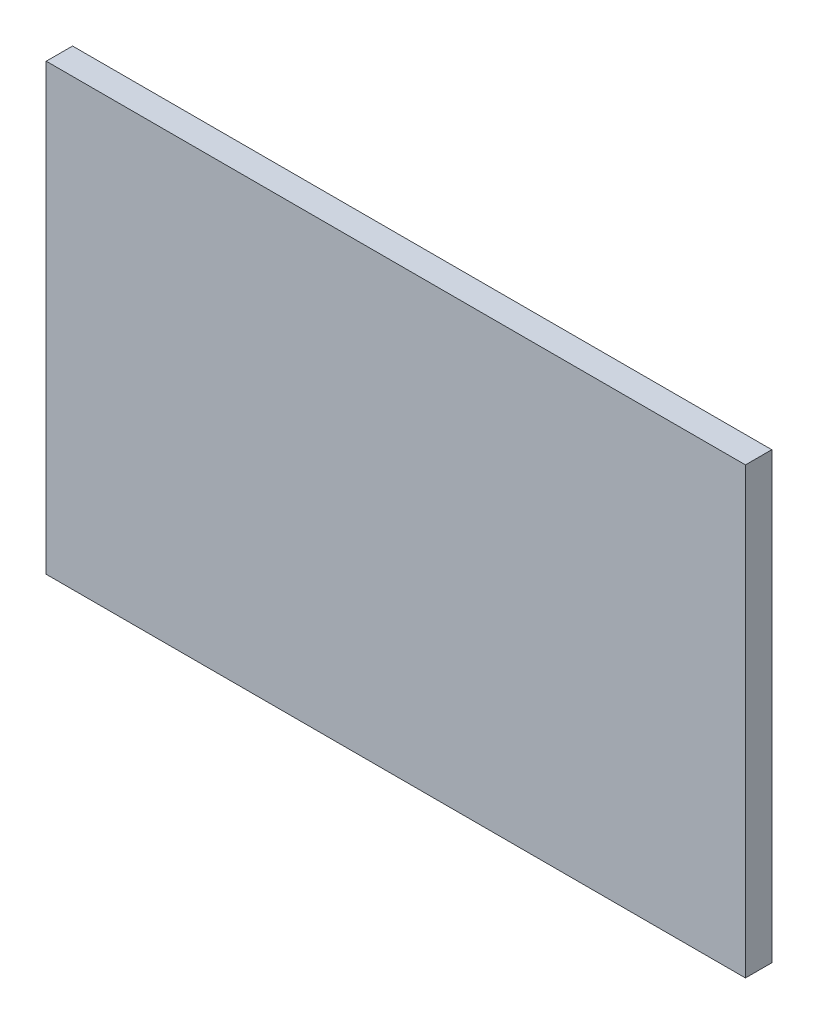
from build123d import *

# Parameters (mm, degrees)
SKETCH1_W           = 531.368
SKETCH1_H           = 337.704321228
BOSS_EXTRUDE1_DEPTH = 20


with BuildPart() as part:
    # Sketch1 → Boss-Extrude1 (new body)
    with BuildSketch(Plane.XY):
        Rectangle(SKETCH1_W, SKETCH1_H)
    extrude(amount=BOSS_EXTRUDE1_DEPTH)


solid = part.part
